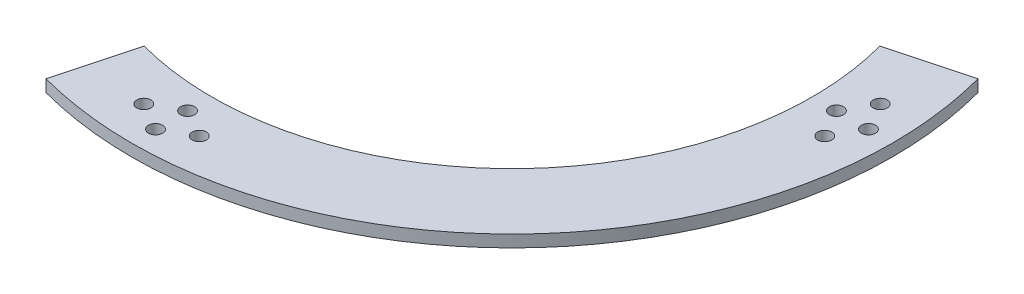
from build123d import *

# Parameters (mm, degrees)
SKETCH_1_R      = 1.75
EXTRUDE_1_DEPTH = 3


with BuildPart() as part:
    # 草图1 → 凸台-拉伸1 (new body)
    with BuildSketch(Plane(origin=(0, 0, 0), x_dir=(1, 0, 0), z_dir=(0, 1, 0))):
        with BuildLine():
            Line((-19.411428383, -72.444436972), (-24.587809285, -91.762953497))
            ThreePointArc((-24.587809285, -91.762953497), (67.175144213, -67.175144213), (91.762953497, 24.587809285))
            Line((91.762953497, 24.587809285), (72.444436972, 19.411428383))
            ThreePointArc((72.444436972, 19.411428383), (53.033008589, -53.033008589), (-19.411428383, -72.444436972))
        make_face()
        with Locations(Location((0, -89, 0), (0, 0, 270))):
            Circle(SKETCH_1_R, mode=Mode.SUBTRACT)
        with Locations(Location((0, -81, 0), (0, 0, 270))):
            Circle(SKETCH_1_R, mode=Mode.SUBTRACT)
        with Locations(Location((-6.92820323, -85, 0), (0, 0, 270))):
            Circle(SKETCH_1_R, mode=Mode.SUBTRACT)
        with Locations(Location((6.92820323, -85, 0), (0, 0, 270))):
            Circle(SKETCH_1_R, mode=Mode.SUBTRACT)
        with Locations(Location((85, -6.92820323, 0), (0, 0, 270))):
            Circle(SKETCH_1_R, mode=Mode.SUBTRACT)
        with Locations(Location((81, 0, 0), (0, 0, 270))):
            Circle(SKETCH_1_R, mode=Mode.SUBTRACT)
        with Locations(Location((85, 6.92820323, 0), (0, 0, 270))):
            Circle(SKETCH_1_R, mode=Mode.SUBTRACT)
        with Locations(Location((89, 0, 0), (0, 0, 270))):
            Circle(SKETCH_1_R, mode=Mode.SUBTRACT)
    extrude(amount=EXTRUDE_1_DEPTH)


solid = part.part
